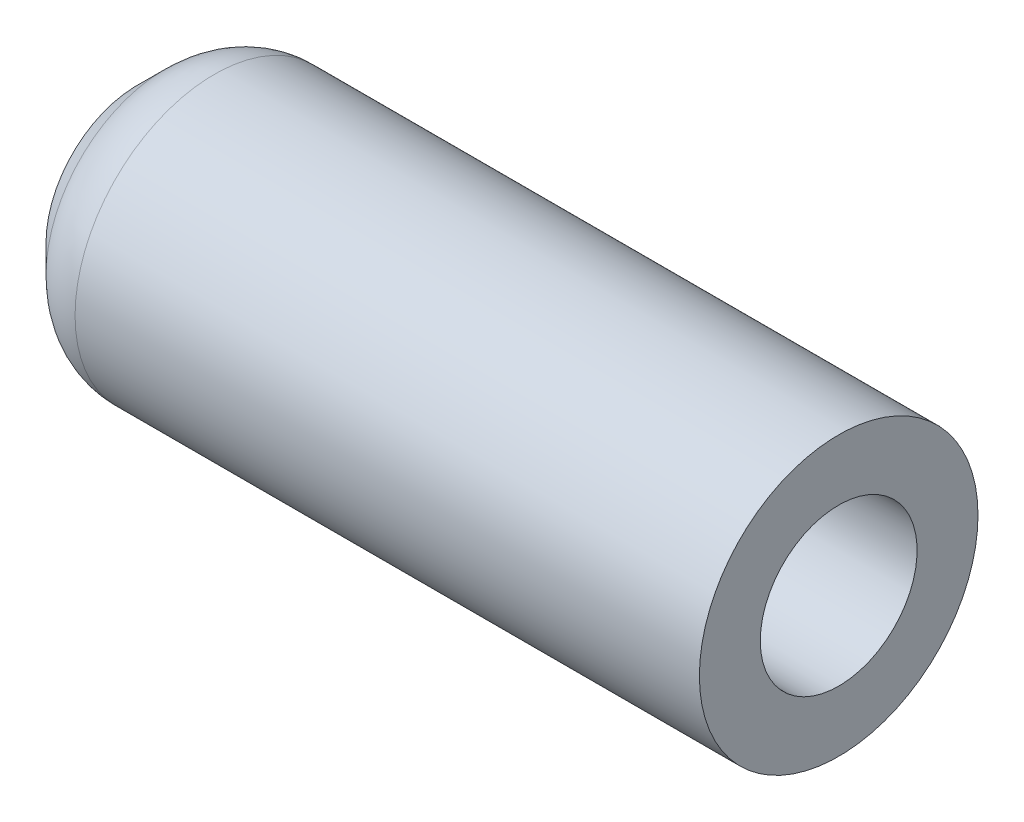
from build123d import *

# Parameters (mm, degrees)
FILLET1_R          = 2.159
SKETCH3_R          = 2.413
CUT_EXTRUDE1_DEPTH = 21.59


with BuildPart() as part:
    # Sketch1 → Revolve1 (revolve)
    with BuildSketch(Plane.XY, mode=Mode.PRIVATE) as revolve1_sk:
        Polygon((0, 0), (0, 2.8), (1.48625, 4.28625), (21.59, 4.28625), (21.59, 0), align=None)
    revolve(revolve1_sk.sketch.rotate(Axis((0, 0, 0), (1, 0, 0)), 90), axis=Axis((0, 0, 0), (1, 0, 0)))

    # Fillet1
    fillet1_edges = [part.edges().sort_by_distance(p)[0] for p in [
        (1.48625, 0, -4.28625),
    ]]
    fillet(fillet1_edges, radius=FILLET1_R)

    # Sketch3 → Cut-Extrude1 (cut)
    with BuildSketch(Plane.ZY):
        Circle(SKETCH3_R)
    extrude(amount=-CUT_EXTRUDE1_DEPTH, mode=Mode.SUBTRACT)


solid = part.part
